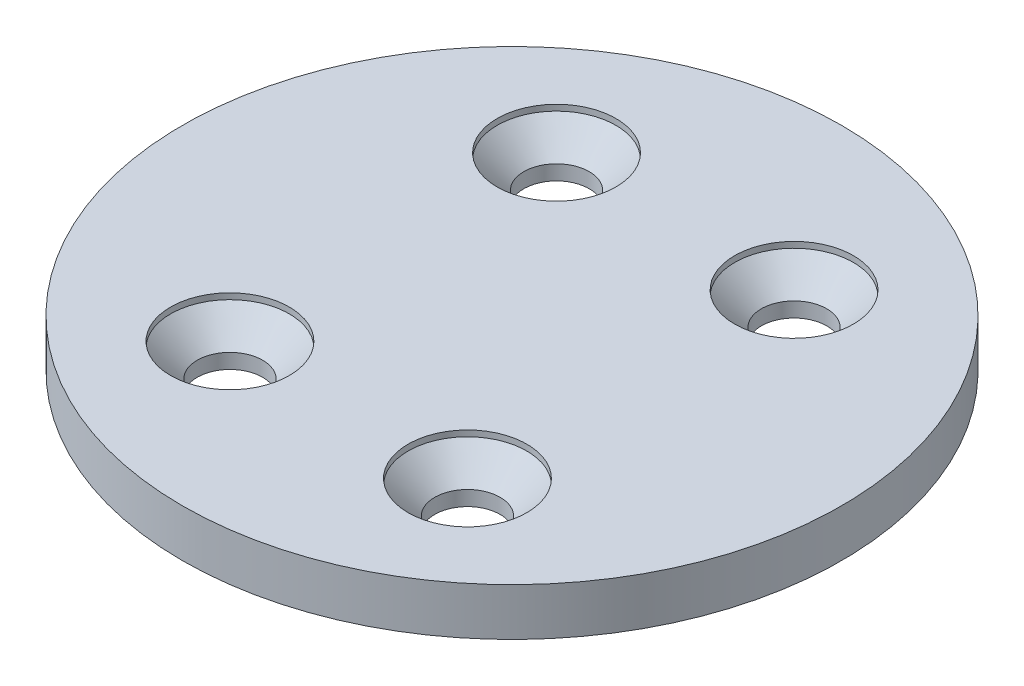
from build123d import *

# Parameters (mm, degrees)
SKETCH1_R                                      = 27.75
SKETCH1_R_2                                    = 2.75
BOSS_EXTRUDE1_DEPTH                            = 4
CSK_FOR_M5_FLAT_HEAD_MACHINE_SCREW1_AT_2_COUNT = 2
CSK_FOR_M5_FLAT_HEAD_MACHINE_SCREW1_AT_2_PITCH = 27.5
CSK_FOR_M5_FLAT_HEAD_MACHINE_SCREW1_AT_3_COUNT = 2
CSK_FOR_M5_FLAT_HEAD_MACHINE_SCREW1_AT_3_PITCH = 34.003676272
CSK_FOR_M5_FLAT_HEAD_MACHINE_SCREW1_AT_4_COUNT = 2
CSK_FOR_M5_FLAT_HEAD_MACHINE_SCREW1_AT_4_PITCH = 20


with BuildPart() as part:
    # Sketch1 → Boss-Extrude1 (new body)
    with BuildSketch(Plane(origin=(0, 0, 0), x_dir=(1, 0, 0), z_dir=(0, 1, 0))):
        with Locations(Location((0, 0, 0), (0, 0, 270))):
            Circle(SKETCH1_R)
        with Locations(Location((-10, 13.75, 0), (0, 0, 270))):
            Circle(SKETCH1_R_2, mode=Mode.SUBTRACT)
        with Locations(Location((10, 13.75, 0), (0, 0, 270))):
            Circle(SKETCH1_R_2, mode=Mode.SUBTRACT)
        with Locations(Location((10, -13.75, 0), (0, 0, 270))):
            Circle(SKETCH1_R_2, mode=Mode.SUBTRACT)
        with Locations(Location((-10, -13.75, 0), (0, 0, 270))):
            Circle(SKETCH1_R_2, mode=Mode.SUBTRACT)
    extrude(amount=BOSS_EXTRUDE1_DEPTH)

    # Sketch20 → CSK for M5 Flat Head Machine Screw1 (revolve, cut)
    with BuildSketch(Plane(origin=(10, 4, -13.75), x_dir=(0, 0, 1), z_dir=(1, 0, 0))):
        Polygon((0, 0), (0, 4), (2.75, 4), (2.75, 2.75), (5, 0.5), (5, 0), align=None)
    csk_for_m5_flat_head_machine_screw1 = revolve(axis=Axis((10, 10.35, -13.75), (0, -1, 0)), mode=Mode.SUBTRACT)

    # CSK for M5 Flat Head Machine Screw1 at 2: CSK for M5 Flat Head Machine Screw1 ×2
    with Locations(*[(0, 0, i * CSK_FOR_M5_FLAT_HEAD_MACHINE_SCREW1_AT_2_PITCH) for i in range(1, CSK_FOR_M5_FLAT_HEAD_MACHINE_SCREW1_AT_2_COUNT)]):
        add(csk_for_m5_flat_head_machine_screw1, mode=Mode.SUBTRACT)

    # CSK for M5 Flat Head Machine Screw1 at 3: CSK for M5 Flat Head Machine Screw1 ×2
    with Locations(*[Vector(-0.588171697675046, 0, 0.8087360843031888) * (i * CSK_FOR_M5_FLAT_HEAD_MACHINE_SCREW1_AT_3_PITCH) for i in range(1, CSK_FOR_M5_FLAT_HEAD_MACHINE_SCREW1_AT_3_COUNT)]):
        add(csk_for_m5_flat_head_machine_screw1, mode=Mode.SUBTRACT)

    # CSK for M5 Flat Head Machine Screw1 at 4: CSK for M5 Flat Head Machine Screw1 ×2
    with Locations(*[(-i * CSK_FOR_M5_FLAT_HEAD_MACHINE_SCREW1_AT_4_PITCH, 0, 0) for i in range(1, CSK_FOR_M5_FLAT_HEAD_MACHINE_SCREW1_AT_4_COUNT)]):
        add(csk_for_m5_flat_head_machine_screw1, mode=Mode.SUBTRACT)


solid = part.part
